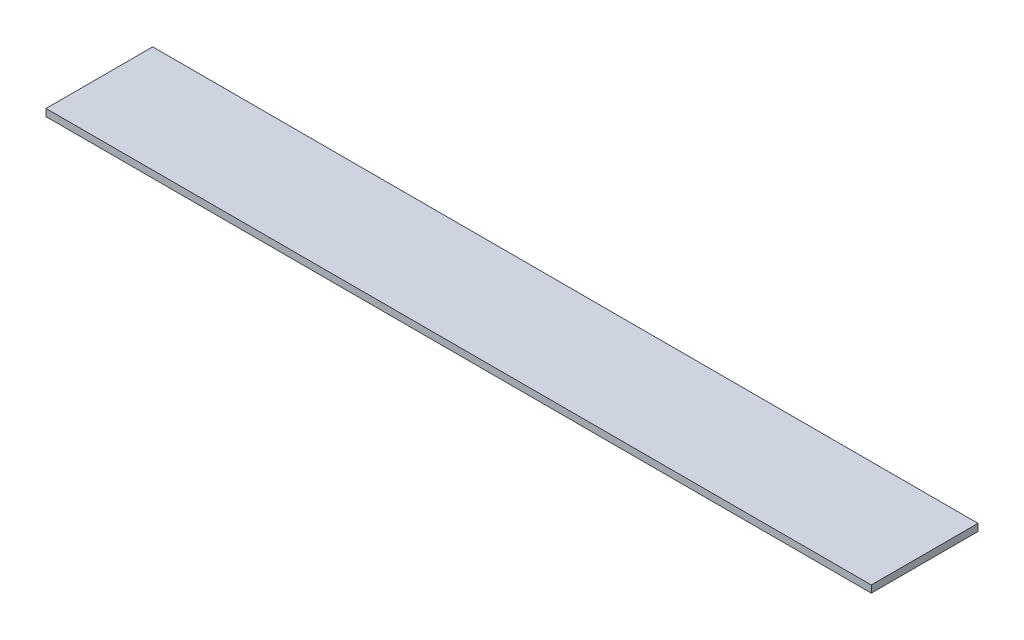
from build123d import *

# Parameters (mm, degrees)
SKETCH1_W           = 580
SKETCH1_H           = 75
BOSS_EXTRUDE1_DEPTH = 5


with BuildPart() as part:
    # Sketch1 → Boss-Extrude1 (new body)
    with BuildSketch(Plane(origin=(0, 0, 0), x_dir=(1, 0, 0), z_dir=(0, 1, 0))):
        Rectangle(SKETCH1_W, SKETCH1_H)
    extrude(amount=BOSS_EXTRUDE1_DEPTH)


solid = part.part
